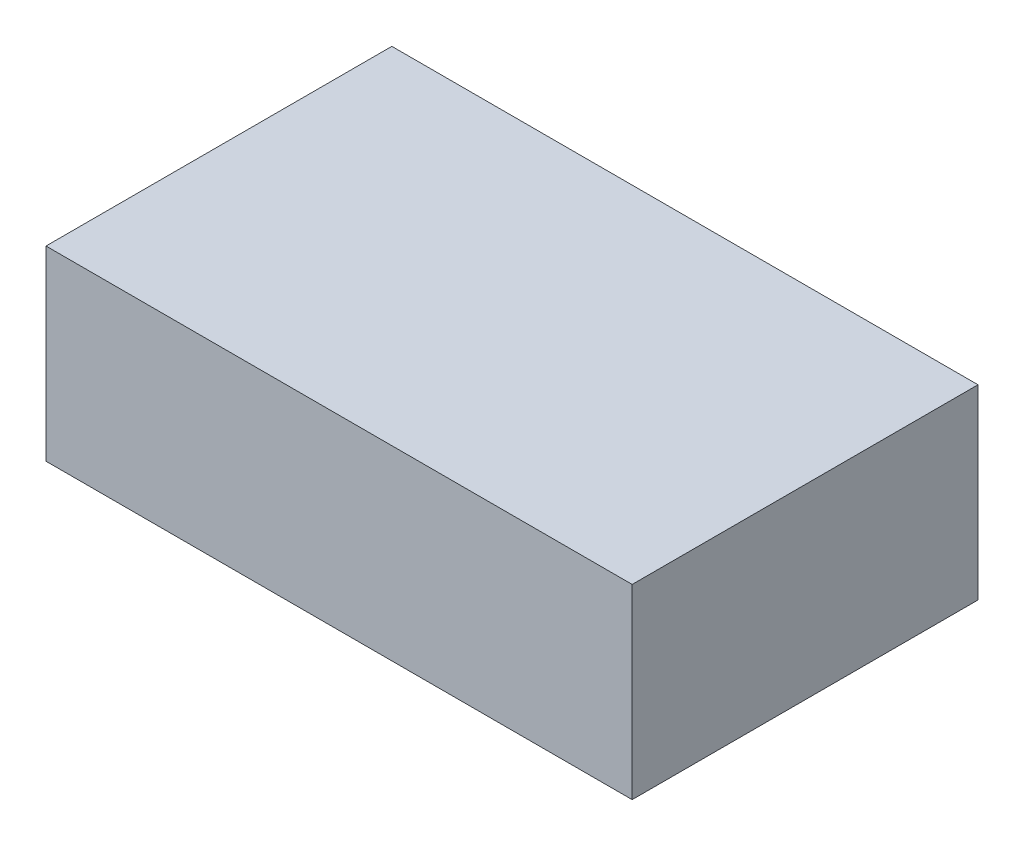
from build123d import *

# Parameters (mm, degrees)
SKETCH1_W           = 10
SKETCH1_H           = 5.9
BOSS_EXTRUDE1_DEPTH = 3.18


with BuildPart() as part:
    # Sketch1 → Boss-Extrude1 (new body)
    with BuildSketch(Plane(origin=(0, 0, 0), x_dir=(1, 0, 0), z_dir=(0, 1, 0))):
        with Locations((5, -2.95)):
            Rectangle(SKETCH1_W, SKETCH1_H)
    extrude(amount=BOSS_EXTRUDE1_DEPTH)


solid = part.part
